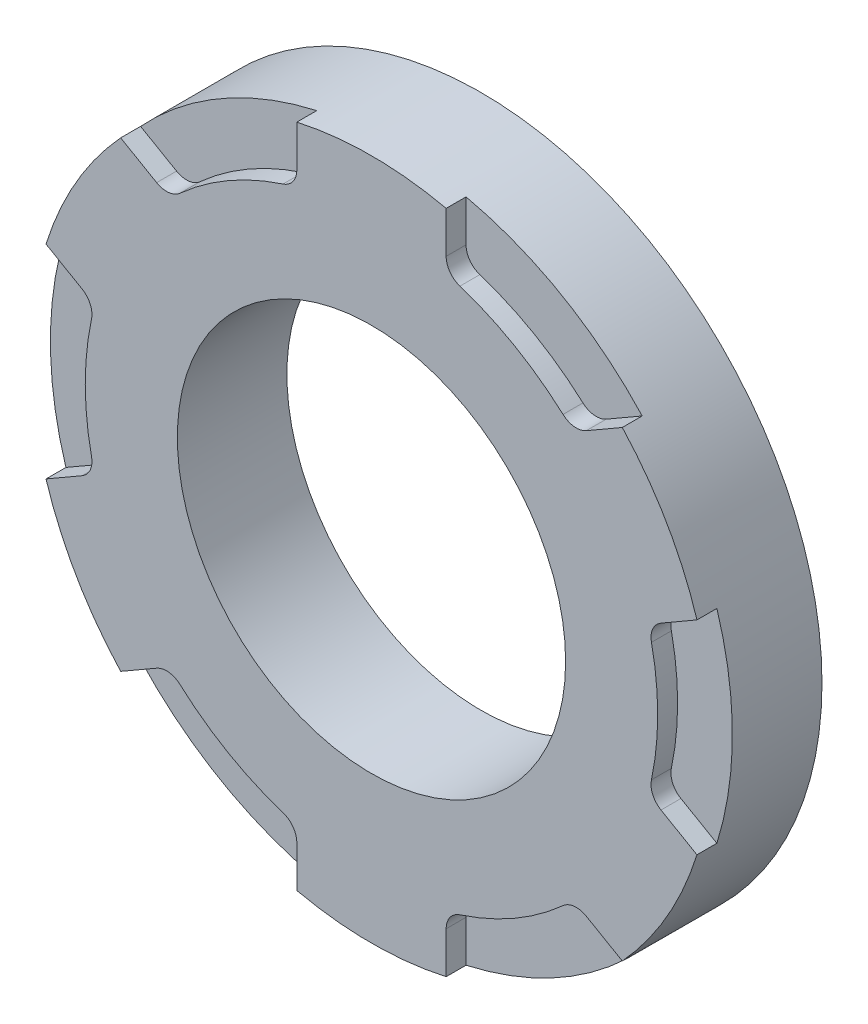
from build123d import *

# Parameters (mm, degrees)
SKETCH1_R           = 8.6995
SKETCH1_R_2         = 4.953
BOSS_EXTRUDE1_DEPTH = 2.794
CUT_EXTRUDE1_START  = -0.508
CUT_EXTRUDE1_DEPTH  = 0.508


with BuildPart() as part:
    # Sketch1 → Boss-Extrude1 (new body)
    with BuildSketch(Plane.XY):
        Circle(SKETCH1_R)
        Circle(SKETCH1_R_2, mode=Mode.SUBTRACT)
    extrude(amount=BOSS_EXTRUDE1_DEPTH)

    # Sketch2 → Cut-Extrude1 (cut)
    with BuildSketch(Plane.XY.offset(2.794).offset(CUT_EXTRUDE1_START)):
        with BuildLine():
            Line((7.385695624, 2.064428831), (8.303636404, 2.594402188))
            ThreePointArc((8.303636404, 2.594402188), (8.6995, 0), (8.303636405, -2.594402188))
            Line((8.303636405, -2.594402188), (7.385695624, -2.064428831))
            ThreePointArc((7.385695624, -2.064428831), (7.175606504, -1.831092109), (7.142804852, -1.518830175))
            ThreePointArc((7.142804852, -1.518830175), (7.3025, 0), (7.142804852, 1.518830175))
            ThreePointArc((7.142804852, 1.518830175), (7.175606504, 1.831092109), (7.385695624, 2.064428831))
        make_face()
        with BuildLine():
            Line((5.480695624, -5.363985619), (6.398636405, -5.893958976))
            ThreePointArc((6.398636405, -5.893958976), (4.34975, -7.533988), (1.905, -8.488361164))
            Line((1.905, -8.488361164), (1.905, -7.428414451))
            ThreePointArc((1.905, -7.428414451), (2.002030969, -7.129803575), (2.256056911, -6.945265543))
            ThreePointArc((2.256056911, -6.945265543), (3.65125, -6.324150511), (4.886747941, -5.426435369))
            ThreePointArc((4.886747941, -5.426435369), (5.173575535, -5.298711465), (5.480695624, -5.363985619))
        make_face()
        with BuildLine():
            Line((-1.905, -7.428414451), (-1.905, -8.488361164))
            ThreePointArc((-1.905, -8.488361164), (-4.34975, -7.533988), (-6.398636404, -5.893958976))
            Line((-6.398636404, -5.893958976), (-5.480695624, -5.36398562))
            ThreePointArc((-5.480695624, -5.36398562), (-5.173575535, -5.298711465), (-4.886747941, -5.426435369))
            ThreePointArc((-4.886747941, -5.426435369), (-3.65125, -6.324150511), (-2.256056911, -6.945265543))
            ThreePointArc((-2.256056911, -6.945265543), (-2.002030969, -7.129803575), (-1.905, -7.428414451))
        make_face()
        with BuildLine():
            Line((-7.385695624, -2.064428831), (-8.303636404, -2.594402188))
            ThreePointArc((-8.303636404, -2.594402188), (-8.6995, 0), (-8.303636405, 2.594402188))
            Line((-8.303636405, 2.594402188), (-7.385695624, 2.064428831))
            ThreePointArc((-7.385695624, 2.064428831), (-7.175606504, 1.831092109), (-7.142804852, 1.518830175))
            ThreePointArc((-7.142804852, 1.518830175), (-7.3025, 0), (-7.142804852, -1.518830175))
            ThreePointArc((-7.142804852, -1.518830175), (-7.175606504, -1.831092109), (-7.385695624, -2.064428831))
        make_face()
        with BuildLine():
            Line((-5.480695624, 5.363985619), (-6.398636405, 5.893958976))
            ThreePointArc((-6.398636405, 5.893958976), (-4.34975, 7.533988), (-1.905, 8.488361164))
            Line((-1.905, 8.488361164), (-1.905, 7.428414451))
            ThreePointArc((-1.905, 7.428414451), (-2.002030969, 7.129803575), (-2.256056911, 6.945265543))
            ThreePointArc((-2.256056911, 6.945265543), (-3.65125, 6.324150511), (-4.886747941, 5.426435369))
            ThreePointArc((-4.886747941, 5.426435369), (-5.173575535, 5.298711465), (-5.480695624, 5.363985619))
        make_face()
        with BuildLine():
            Line((6.398636404, 5.893958976), (5.480695624, 5.36398562))
            ThreePointArc((5.480695624, 5.36398562), (5.173575535, 5.298711465), (4.886747941, 5.426435369))
            ThreePointArc((4.886747941, 5.426435369), (3.65125, 6.324150511), (2.256056911, 6.945265543))
            ThreePointArc((2.256056911, 6.945265543), (2.002030969, 7.129803575), (1.905, 7.428414451))
            Line((1.905, 7.428414451), (1.905, 8.488361164))
            ThreePointArc((1.905, 8.488361164), (4.34975, 7.533988), (6.398636404, 5.893958976))
        make_face()
    extrude(amount=CUT_EXTRUDE1_DEPTH, mode=Mode.SUBTRACT)


solid = part.part
